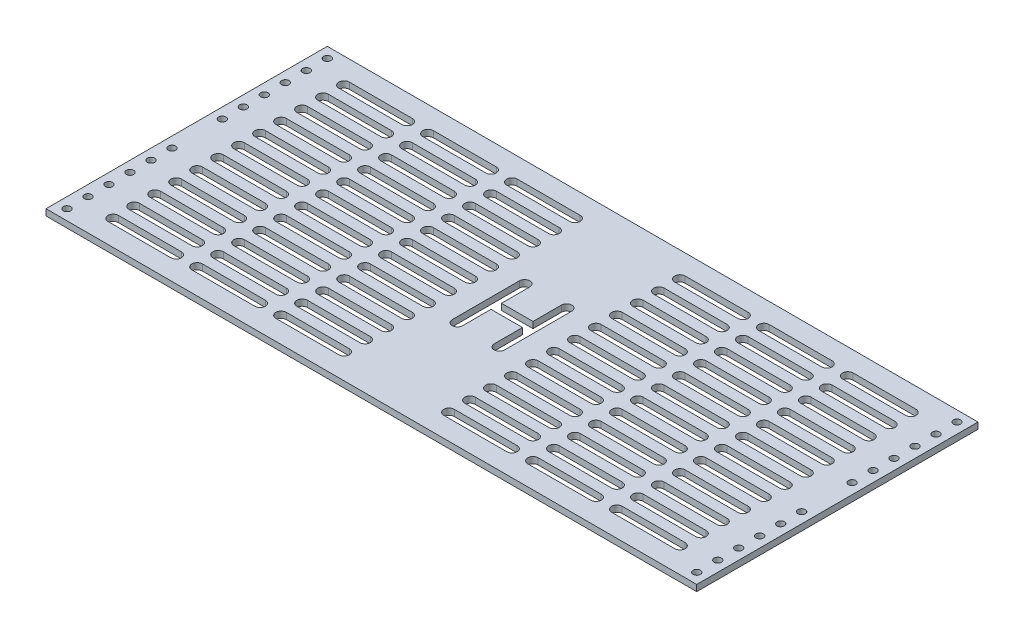
from build123d import *

# Parameters (mm, degrees)
EXTRUDE_1_DEPTH          = 3
CUT_EXTRUDE_5_DEPTH      = 10
CUT_EXTRUDE_2_DEPTH      = 205.914616365
MIRROR_2_COPY_1_DEPTH    = 205.914616365
SKETCH_4_R               = 1.75
CUT_EXTRUDE_3_DEPTH      = 205.914616365
MIRROR_4_COPY_1_SKETCH_R = 1.75
MIRROR_4_COPY_1_DEPTH    = 205.914616365


with BuildPart() as part:
    # 草图1 → 凸台-拉伸1 (new body)
    with BuildSketch(Plane(origin=(0, 0, 0), x_dir=(1, 0, 0), z_dir=(0, 1, 0))):
        Polygon((0, 0), (-155, 0), (-155, -134), (155, -134), (155, 0), align=None)
    extrude(amount=EXTRUDE_1_DEPTH)

    # 草图2 → 切除-拉伸5 (cut)
    with BuildSketch(Plane(origin=(0, 3, 0), x_dir=(1, 0, 0), z_dir=(0, 1, 0))):
        with BuildLine():
            Line((-7.5, -51), (-7.5, -83))
            ThreePointArc((-7.5, -83), (-10, -85.5), (-12.5, -83))
            Line((-12.5, -83), (-12.5, -51))
            ThreePointArc((-12.5, -51), (-10, -48.5), (-7.5, -51))
        make_face()
        with BuildLine():
            Line((-10, -64.5), (10, -64.5))
            ThreePointArc((10, -64.5), (12.5, -67), (10, -69.5))
            Line((10, -69.5), (-10, -69.5))
            ThreePointArc((-10, -69.5), (-12.5, -67), (-10, -64.5))
        make_face()
        with BuildLine():
            Line((12.5, -51), (12.5, -83))
            ThreePointArc((12.5, -83), (10, -85.5), (7.5, -83))
            Line((7.5, -83), (7.5, -51))
            ThreePointArc((7.5, -51), (10, -48.5), (12.5, -51))
        make_face()
    extrude(amount=-CUT_EXTRUDE_5_DEPTH, mode=Mode.SUBTRACT)

    # 草图3 → 切除-拉伸2 (cut, through all)
    with BuildSketch(Plane(origin=(0, 3, 0), x_dir=(1, 0, 0), z_dir=(0, 1, 0))):
        with BuildLine():
            ThreePointArc((-135, -119.5), (-137.5, -122), (-135, -124.5))
            Line((-135, -124.5), (-105, -124.5))
            ThreePointArc((-105, -124.5), (-102.5, -122), (-105, -119.5))
            Line((-105, -119.5), (-135, -119.5))
        make_face()
        with BuildLine():
            ThreePointArc((-55, -119.5), (-57.5, -122), (-55, -124.5))
            Line((-55, -124.5), (-25, -124.5))
            ThreePointArc((-25, -124.5), (-22.5, -122), (-25, -119.5))
            Line((-25, -119.5), (-55, -119.5))
        make_face()
        with BuildLine():
            ThreePointArc((-95, -119.5), (-97.5, -122), (-95, -124.5))
            Line((-95, -124.5), (-65, -124.5))
            ThreePointArc((-65, -124.5), (-62.5, -122), (-65, -119.5))
            Line((-65, -119.5), (-95, -119.5))
        make_face()
        with BuildLine():
            ThreePointArc((-135, -109.5), (-137.5, -112), (-135, -114.5))
            Line((-135, -114.5), (-105, -114.5))
            ThreePointArc((-105, -114.5), (-102.5, -112), (-105, -109.5))
            Line((-105, -109.5), (-135, -109.5))
        make_face()
        with BuildLine():
            ThreePointArc((-95, -109.5), (-97.5, -112), (-95, -114.5))
            Line((-95, -114.5), (-65, -114.5))
            ThreePointArc((-65, -114.5), (-62.5, -112), (-65, -109.5))
            Line((-65, -109.5), (-95, -109.5))
        make_face()
        with BuildLine():
            ThreePointArc((-55, -109.5), (-57.5, -112), (-55, -114.5))
            Line((-55, -114.5), (-25, -114.5))
            ThreePointArc((-25, -114.5), (-22.5, -112), (-25, -109.5))
            Line((-25, -109.5), (-55, -109.5))
        make_face()
        with BuildLine():
            ThreePointArc((-135, -99.5), (-137.5, -102), (-135, -104.5))
            Line((-135, -104.5), (-105, -104.5))
            ThreePointArc((-105, -104.5), (-102.5, -102), (-105, -99.5))
            Line((-105, -99.5), (-135, -99.5))
        make_face()
        with BuildLine():
            ThreePointArc((-95, -99.5), (-97.5, -102), (-95, -104.5))
            Line((-95, -104.5), (-65, -104.5))
            ThreePointArc((-65, -104.5), (-62.5, -102), (-65, -99.5))
            Line((-65, -99.5), (-95, -99.5))
        make_face()
        with BuildLine():
            ThreePointArc((-55, -99.5), (-57.5, -102), (-55, -104.5))
            Line((-55, -104.5), (-25, -104.5))
            ThreePointArc((-25, -104.5), (-22.5, -102), (-25, -99.5))
            Line((-25, -99.5), (-55, -99.5))
        make_face()
        with BuildLine():
            ThreePointArc((-135, -89.5), (-137.5, -92), (-135, -94.5))
            Line((-135, -94.5), (-105, -94.5))
            ThreePointArc((-105, -94.5), (-102.5, -92), (-105, -89.5))
            Line((-105, -89.5), (-135, -89.5))
        make_face()
        with BuildLine():
            ThreePointArc((-95, -89.5), (-97.5, -92), (-95, -94.5))
            Line((-95, -94.5), (-65, -94.5))
            ThreePointArc((-65, -94.5), (-62.5, -92), (-65, -89.5))
            Line((-65, -89.5), (-95, -89.5))
        make_face()
        with BuildLine():
            ThreePointArc((-55, -89.5), (-57.5, -92), (-55, -94.5))
            Line((-55, -94.5), (-25, -94.5))
            ThreePointArc((-25, -94.5), (-22.5, -92), (-25, -89.5))
            Line((-25, -89.5), (-55, -89.5))
        make_face()
        with BuildLine():
            ThreePointArc((-135, -79.5), (-137.5, -82), (-135, -84.5))
            Line((-135, -84.5), (-105, -84.5))
            ThreePointArc((-105, -84.5), (-102.5, -82), (-105, -79.5))
            Line((-105, -79.5), (-135, -79.5))
        make_face()
        with BuildLine():
            ThreePointArc((-95, -79.5), (-97.5, -82), (-95, -84.5))
            Line((-95, -84.5), (-65, -84.5))
            ThreePointArc((-65, -84.5), (-62.5, -82), (-65, -79.5))
            Line((-65, -79.5), (-95, -79.5))
        make_face()
        with BuildLine():
            ThreePointArc((-55, -79.5), (-57.5, -82), (-55, -84.5))
            Line((-55, -84.5), (-25, -84.5))
            ThreePointArc((-25, -84.5), (-22.5, -82), (-25, -79.5))
            Line((-25, -79.5), (-55, -79.5))
        make_face()
        with BuildLine():
            ThreePointArc((-135, -69.5), (-137.5, -72), (-135, -74.5))
            Line((-135, -74.5), (-105, -74.5))
            ThreePointArc((-105, -74.5), (-102.5, -72), (-105, -69.5))
            Line((-105, -69.5), (-135, -69.5))
        make_face()
        with BuildLine():
            ThreePointArc((-95, -69.5), (-97.5, -72), (-95, -74.5))
            Line((-95, -74.5), (-65, -74.5))
            ThreePointArc((-65, -74.5), (-62.5, -72), (-65, -69.5))
            Line((-65, -69.5), (-95, -69.5))
        make_face()
        with BuildLine():
            ThreePointArc((-55, -69.5), (-57.5, -72), (-55, -74.5))
            Line((-55, -74.5), (-25, -74.5))
            ThreePointArc((-25, -74.5), (-22.5, -72), (-25, -69.5))
            Line((-25, -69.5), (-55, -69.5))
        make_face()
    cut_extrude_2 = extrude(amount=-CUT_EXTRUDE_2_DEPTH, mode=Mode.SUBTRACT)

    # 镜向1: 切除-拉伸2 across plane
    add(cut_extrude_2.mirror(Plane.XY.offset(67)), mode=Mode.SUBTRACT)

    # 镜向2: 切除-拉伸2 across plane
    add(cut_extrude_2.mirror(Plane(origin=(0, 0, 0), x_dir=(0, 0, 1), z_dir=(1, 0, 0))), mode=Mode.SUBTRACT)

    # 镜向2 copy 1 sketch → 镜向2 copy 1 (cut, through all)
    with BuildSketch(Plane(origin=(0, 3, 134), x_dir=(-1, 0, 0), z_dir=(0, 1, 0))):
        with BuildLine():
            ThreePointArc((-135, -119.5), (-137.5, -122), (-135, -124.5))
            Line((-135, -124.5), (-105, -124.5))
            ThreePointArc((-105, -124.5), (-102.5, -122), (-105, -119.5))
            Line((-105, -119.5), (-135, -119.5))
        make_face()
        with BuildLine():
            ThreePointArc((-55, -119.5), (-57.5, -122), (-55, -124.5))
            Line((-55, -124.5), (-25, -124.5))
            ThreePointArc((-25, -124.5), (-22.5, -122), (-25, -119.5))
            Line((-25, -119.5), (-55, -119.5))
        make_face()
        with BuildLine():
            ThreePointArc((-95, -119.5), (-97.5, -122), (-95, -124.5))
            Line((-95, -124.5), (-65, -124.5))
            ThreePointArc((-65, -124.5), (-62.5, -122), (-65, -119.5))
            Line((-65, -119.5), (-95, -119.5))
        make_face()
        with BuildLine():
            ThreePointArc((-135, -109.5), (-137.5, -112), (-135, -114.5))
            Line((-135, -114.5), (-105, -114.5))
            ThreePointArc((-105, -114.5), (-102.5, -112), (-105, -109.5))
            Line((-105, -109.5), (-135, -109.5))
        make_face()
        with BuildLine():
            ThreePointArc((-95, -109.5), (-97.5, -112), (-95, -114.5))
            Line((-95, -114.5), (-65, -114.5))
            ThreePointArc((-65, -114.5), (-62.5, -112), (-65, -109.5))
            Line((-65, -109.5), (-95, -109.5))
        make_face()
        with BuildLine():
            ThreePointArc((-55, -109.5), (-57.5, -112), (-55, -114.5))
            Line((-55, -114.5), (-25, -114.5))
            ThreePointArc((-25, -114.5), (-22.5, -112), (-25, -109.5))
            Line((-25, -109.5), (-55, -109.5))
        make_face()
        with BuildLine():
            ThreePointArc((-135, -99.5), (-137.5, -102), (-135, -104.5))
            Line((-135, -104.5), (-105, -104.5))
            ThreePointArc((-105, -104.5), (-102.5, -102), (-105, -99.5))
            Line((-105, -99.5), (-135, -99.5))
        make_face()
        with BuildLine():
            ThreePointArc((-95, -99.5), (-97.5, -102), (-95, -104.5))
            Line((-95, -104.5), (-65, -104.5))
            ThreePointArc((-65, -104.5), (-62.5, -102), (-65, -99.5))
            Line((-65, -99.5), (-95, -99.5))
        make_face()
        with BuildLine():
            ThreePointArc((-55, -99.5), (-57.5, -102), (-55, -104.5))
            Line((-55, -104.5), (-25, -104.5))
            ThreePointArc((-25, -104.5), (-22.5, -102), (-25, -99.5))
            Line((-25, -99.5), (-55, -99.5))
        make_face()
        with BuildLine():
            ThreePointArc((-135, -89.5), (-137.5, -92), (-135, -94.5))
            Line((-135, -94.5), (-105, -94.5))
            ThreePointArc((-105, -94.5), (-102.5, -92), (-105, -89.5))
            Line((-105, -89.5), (-135, -89.5))
        make_face()
        with BuildLine():
            ThreePointArc((-95, -89.5), (-97.5, -92), (-95, -94.5))
            Line((-95, -94.5), (-65, -94.5))
            ThreePointArc((-65, -94.5), (-62.5, -92), (-65, -89.5))
            Line((-65, -89.5), (-95, -89.5))
        make_face()
        with BuildLine():
            ThreePointArc((-55, -89.5), (-57.5, -92), (-55, -94.5))
            Line((-55, -94.5), (-25, -94.5))
            ThreePointArc((-25, -94.5), (-22.5, -92), (-25, -89.5))
            Line((-25, -89.5), (-55, -89.5))
        make_face()
        with BuildLine():
            ThreePointArc((-135, -79.5), (-137.5, -82), (-135, -84.5))
            Line((-135, -84.5), (-105, -84.5))
            ThreePointArc((-105, -84.5), (-102.5, -82), (-105, -79.5))
            Line((-105, -79.5), (-135, -79.5))
        make_face()
        with BuildLine():
            ThreePointArc((-95, -79.5), (-97.5, -82), (-95, -84.5))
            Line((-95, -84.5), (-65, -84.5))
            ThreePointArc((-65, -84.5), (-62.5, -82), (-65, -79.5))
            Line((-65, -79.5), (-95, -79.5))
        make_face()
        with BuildLine():
            ThreePointArc((-55, -79.5), (-57.5, -82), (-55, -84.5))
            Line((-55, -84.5), (-25, -84.5))
            ThreePointArc((-25, -84.5), (-22.5, -82), (-25, -79.5))
            Line((-25, -79.5), (-55, -79.5))
        make_face()
        with BuildLine():
            ThreePointArc((-135, -69.5), (-137.5, -72), (-135, -74.5))
            Line((-135, -74.5), (-105, -74.5))
            ThreePointArc((-105, -74.5), (-102.5, -72), (-105, -69.5))
            Line((-105, -69.5), (-135, -69.5))
        make_face()
        with BuildLine():
            ThreePointArc((-95, -69.5), (-97.5, -72), (-95, -74.5))
            Line((-95, -74.5), (-65, -74.5))
            ThreePointArc((-65, -74.5), (-62.5, -72), (-65, -69.5))
            Line((-65, -69.5), (-95, -69.5))
        make_face()
        with BuildLine():
            ThreePointArc((-55, -69.5), (-57.5, -72), (-55, -74.5))
            Line((-55, -74.5), (-25, -74.5))
            ThreePointArc((-25, -74.5), (-22.5, -72), (-25, -69.5))
            Line((-25, -69.5), (-55, -69.5))
        make_face()
    extrude(amount=-MIRROR_2_COPY_1_DEPTH, mode=Mode.SUBTRACT)

    # 草图4 → 切除-拉伸3 (cut, through all)
    with BuildSketch(Plane(origin=(0, 3, 0), x_dir=(1, 0, 0), z_dir=(0, 1, 0))):
        with Locations(Location((-150, -129, 0), (0, 0, 270))):
            Circle(SKETCH_4_R)
        with Locations(Location((-150, -119, 0), (0, 0, 270))):
            Circle(SKETCH_4_R)
        with Locations(Location((-150, -109, 0), (0, 0, 270))):
            Circle(SKETCH_4_R)
        with Locations(Location((-150, -99, 0), (0, 0, 270))):
            Circle(SKETCH_4_R)
        with Locations(Location((-150, -89, 0), (0, 0, 270))):
            Circle(SKETCH_4_R)
        with Locations(Location((-150, -79, 0), (0, 0, 270))):
            Circle(SKETCH_4_R)
    cut_extrude_3 = extrude(amount=-CUT_EXTRUDE_3_DEPTH, mode=Mode.SUBTRACT)

    # 镜向3: 切除-拉伸3 across plane
    add(cut_extrude_3.mirror(Plane.XY.offset(67)), mode=Mode.SUBTRACT)

    # 镜向4: 切除-拉伸3 across plane
    add(cut_extrude_3.mirror(Plane(origin=(0, 0, 0), x_dir=(0, 0, 1), z_dir=(1, 0, 0))), mode=Mode.SUBTRACT)

    # 镜向4 copy 1 sketch → 镜向4 copy 1 (cut, through all)
    with BuildSketch(Plane(origin=(0, 3, 134), x_dir=(-1, 0, 0), z_dir=(0, 1, 0))):
        with Locations(Location((-150, -129, 0), (0, 0, 270))):
            Circle(MIRROR_4_COPY_1_SKETCH_R)
        with Locations(Location((-150, -119, 0), (0, 0, 270))):
            Circle(MIRROR_4_COPY_1_SKETCH_R)
        with Locations(Location((-150, -109, 0), (0, 0, 270))):
            Circle(MIRROR_4_COPY_1_SKETCH_R)
        with Locations(Location((-150, -99, 0), (0, 0, 270))):
            Circle(MIRROR_4_COPY_1_SKETCH_R)
        with Locations(Location((-150, -89, 0), (0, 0, 270))):
            Circle(MIRROR_4_COPY_1_SKETCH_R)
        with Locations(Location((-150, -79, 0), (0, 0, 270))):
            Circle(MIRROR_4_COPY_1_SKETCH_R)
    extrude(amount=-MIRROR_4_COPY_1_DEPTH, mode=Mode.SUBTRACT)


solid = part.part
